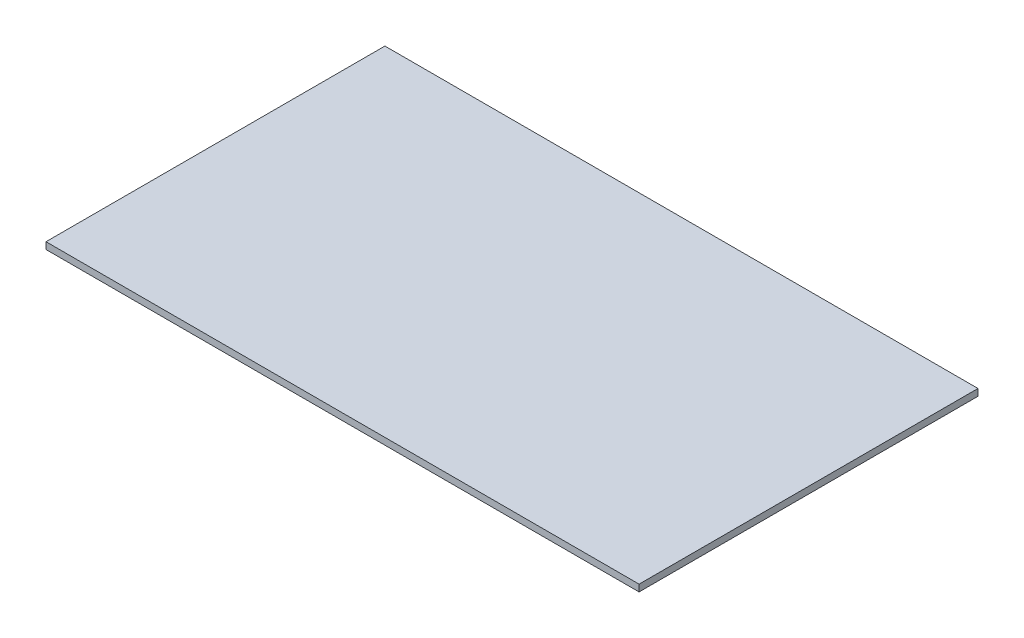
from build123d import *

# Parameters (mm, degrees)
SKETCH1_W           = 70
SKETCH1_H           = 40
BOSS_EXTRUDE1_DEPTH = 0.8


with BuildPart() as part:
    # Sketch1 → Boss-Extrude1 (new body)
    with BuildSketch(Plane(origin=(0, 0, 0), x_dir=(1, 0, 0), z_dir=(0, 1, 0))):
        Rectangle(SKETCH1_W, SKETCH1_H)
    extrude(amount=BOSS_EXTRUDE1_DEPTH)


solid = part.part
